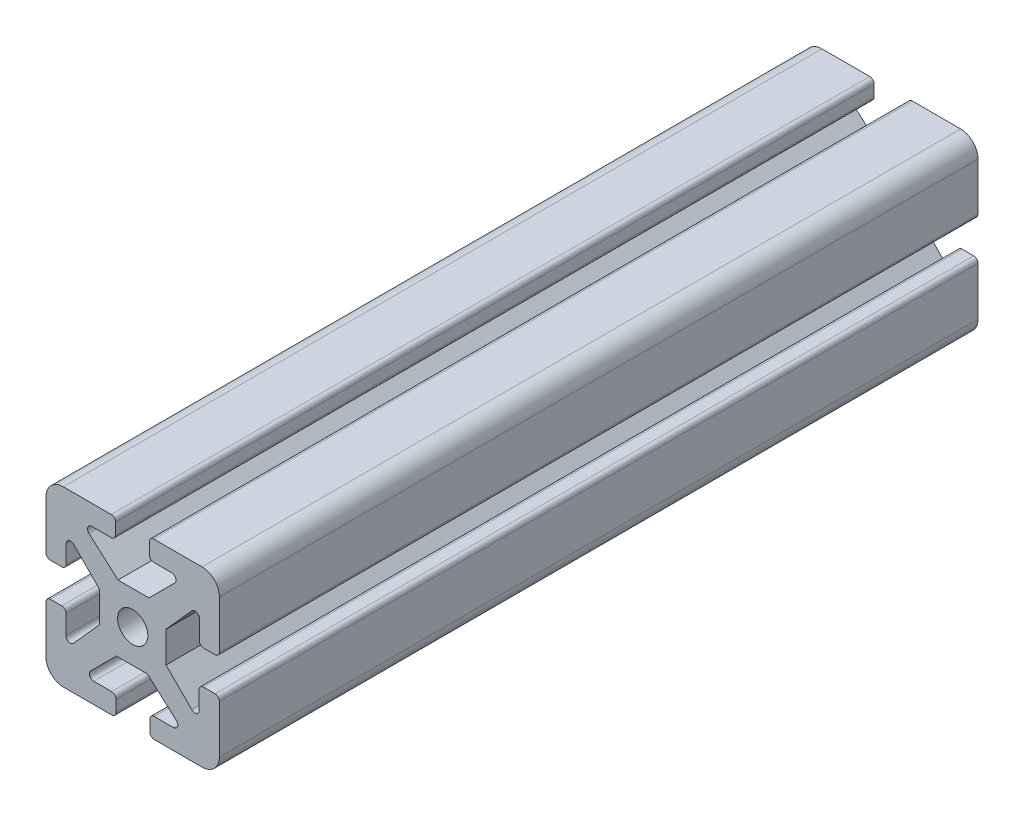
from build123d import *

# Parameters (mm, degrees)
SKETCH2_R           = 3.492543695
BOSS_EXTRUDE1_DEPTH = 175


with BuildPart() as part:
    # Sketch2 → Boss-Extrude1 (new body)
    with BuildSketch(Plane.XY):
        with BuildLine():
            Line((19.48831917, 27.684671829), (23.749889801, 27.684671829))
            Line((23.749889801, 27.684671829), (29.699681879, 33.624984685))
            ThreePointArc((29.699681879, 33.624984685), (29.917171057, 34.714970099), (28.993139054, 35.332654972))
            Line((28.993139054, 35.332654972), (24.845630957, 35.332654972))
            ThreePointArc((24.845630957, 35.332654972), (24.138524175, 35.625548191), (23.845630957, 36.332654972))
            Line((23.845630957, 36.332654972), (23.845630957, 39))
            ThreePointArc((23.845630957, 39), (24.138524175, 39.707106781), (24.845630957, 40))
            Line((24.845630957, 40), (36, 40))
            ThreePointArc((36, 40), (38.828427125, 38.828427125), (40, 36))
            Line((40, 36), (40, 24.961087436))
            ThreePointArc((40, 24.961087436), (39.707106781, 24.253980655), (39, 23.961087436))
            Line((39, 23.961087436), (36.388269628, 23.961087436))
            ThreePointArc((36.388269628, 23.961087436), (35.681162846, 24.253980655), (35.388269628, 24.961087436))
            Line((35.388269628, 24.961087436), (35.388269628, 29.408620307))
            ThreePointArc((35.388269628, 29.408620307), (34.744223919, 30.343123673), (33.641676542, 30.073901274))
            Line((33.641676542, 30.073901274), (27.684671829, 23.388818206))
            Line((27.684671829, 23.388818206), (27.684671829, 20.51168083))
            Line((27.684671829, 20.51168083), (27.684671829, 16.250110199))
            Line((27.684671829, 16.250110199), (33.624984685, 10.300318121))
            ThreePointArc((33.624984685, 10.300318121), (34.714970099, 10.082828943), (35.332654972, 11.006860946))
            Line((35.332654972, 11.006860946), (35.332654972, 15.154369043))
            ThreePointArc((35.332654972, 15.154369043), (35.625548191, 15.861475825), (36.332654972, 16.154369043))
            Line((36.332654972, 16.154369043), (39, 16.154369043))
            ThreePointArc((39, 16.154369043), (39.707106781, 15.861475825), (40, 15.154369043))
            Line((40, 15.154369043), (40, 4))
            ThreePointArc((40, 4), (38.828427125, 1.171572875), (36, 0))
            Line((36, 0), (24.961087436, 0))
            ThreePointArc((24.961087436, 0), (24.253980655, 0.292893219), (23.961087436, 1))
            Line((23.961087436, 1), (23.961087436, 3.611730372))
            ThreePointArc((23.961087436, 3.611730372), (24.253980655, 4.318837154), (24.961087436, 4.611730372))
            Line((24.961087436, 4.611730372), (29.408620307, 4.611730372))
            ThreePointArc((29.408620307, 4.611730372), (30.343123673, 5.255776081), (30.073901274, 6.358323458))
            Line((30.073901274, 6.358323458), (23.388818206, 12.315328171))
            Line((23.388818206, 12.315328171), (20.51168083, 12.315328171))
            Line((20.51168083, 12.315328171), (16.250110199, 12.315328171))
            Line((16.250110199, 12.315328171), (10.300318121, 6.375015315))
            ThreePointArc((10.300318121, 6.375015315), (10.082828943, 5.285029901), (11.006860946, 4.667345028))
            Line((11.006860946, 4.667345028), (15.154369043, 4.667345028))
            ThreePointArc((15.154369043, 4.667345028), (15.861475825, 4.374451809), (16.154369043, 3.667345028))
            Line((16.154369043, 3.667345028), (16.154369043, 1))
            ThreePointArc((16.154369043, 1), (15.861475825, 0.292893219), (15.154369043, 0))
            Line((15.154369043, 0), (4, 0))
            ThreePointArc((4, 0), (1.171572875, 1.171572875), (0, 4))
            Line((0, 4), (0, 15.038912564))
            ThreePointArc((0, 15.038912564), (0.292893219, 15.746019345), (1, 16.038912564))
            Line((1, 16.038912564), (3.611730372, 16.038912564))
            ThreePointArc((3.611730372, 16.038912564), (4.318837154, 15.746019345), (4.611730372, 15.038912564))
            Line((4.611730372, 15.038912564), (4.611730372, 10.591379693))
            ThreePointArc((4.611730372, 10.591379693), (5.255776081, 9.656876327), (6.358323458, 9.926098726))
            Line((6.358323458, 9.926098726), (12.315328171, 16.611181794))
            Line((12.315328171, 16.611181794), (12.315328171, 19.48831917))
            Line((12.315328171, 19.48831917), (12.315328171, 23.749889801))
            Line((12.315328171, 23.749889801), (6.375015315, 29.699681879))
            ThreePointArc((6.375015315, 29.699681879), (5.285029901, 29.917171057), (4.667345028, 28.993139054))
            Line((4.667345028, 28.993139054), (4.667345028, 24.845630957))
            ThreePointArc((4.667345028, 24.845630957), (4.374451809, 24.138524175), (3.667345028, 23.845630957))
            Line((3.667345028, 23.845630957), (1, 23.845630957))
            ThreePointArc((1, 23.845630957), (0.292893219, 24.138524175), (0, 24.845630957))
            Line((0, 24.845630957), (0, 36))
            ThreePointArc((0, 36), (1.171572875, 38.828427125), (4, 40))
            Line((4, 40), (15.038912564, 40))
            ThreePointArc((15.038912564, 40), (15.746019345, 39.707106781), (16.038912564, 39))
            Line((16.038912564, 39), (16.038912564, 36.388269628))
            ThreePointArc((16.038912564, 36.388269628), (15.746019345, 35.681162846), (15.038912564, 35.388269628))
            Line((15.038912564, 35.388269628), (10.591379693, 35.388269628))
            ThreePointArc((10.591379693, 35.388269628), (9.656876327, 34.744223919), (9.926098726, 33.641676542))
            Line((9.926098726, 33.641676542), (16.611181794, 27.684671829))
            Line((16.611181794, 27.684671829), (19.48831917, 27.684671829))
        make_face()
        with Locations((20, 20)):
            Circle(SKETCH2_R, mode=Mode.SUBTRACT)
    extrude(amount=BOSS_EXTRUDE1_DEPTH)


solid = part.part
